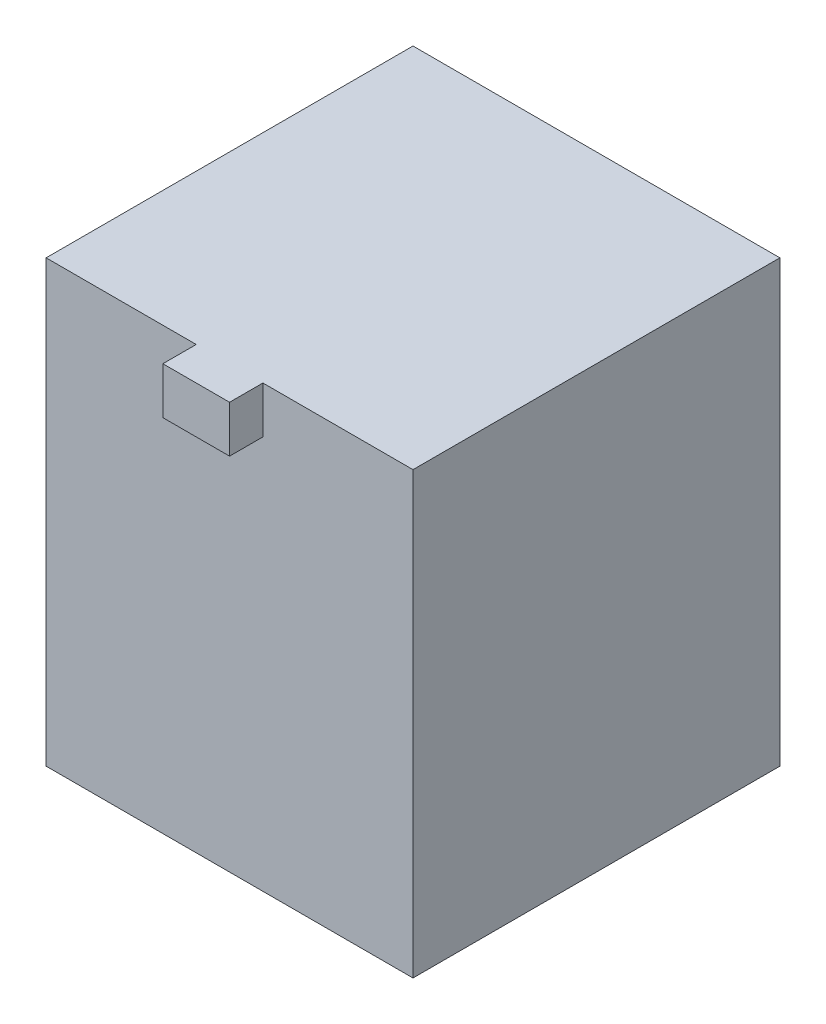
from build123d import *

# Parameters (mm, degrees)
SKETCH_1_W      = 55
SKETCH_1_H      = 55
EXTRUDE_1_DEPTH = 66
SKETCH_2_W      = 10
SKETCH_2_H      = 7
EXTRUDE_2_DEPTH = 5


with BuildPart() as part:
    # 草图1 → 凸台-拉伸1 (new body)
    with BuildSketch(Plane(origin=(0, 0, 0), x_dir=(1, 0, 0), z_dir=(0, 1, 0))):
        Rectangle(SKETCH_1_W, SKETCH_1_H)
    extrude(amount=EXTRUDE_1_DEPTH)

    # 草图2 → 凸台-拉伸2 (add)
    with BuildSketch(Plane.XY.offset(27.5)):
        with Locations((0, 62.5)):
            Rectangle(SKETCH_2_W, SKETCH_2_H)
    extrude(amount=EXTRUDE_2_DEPTH)


solid = part.part
